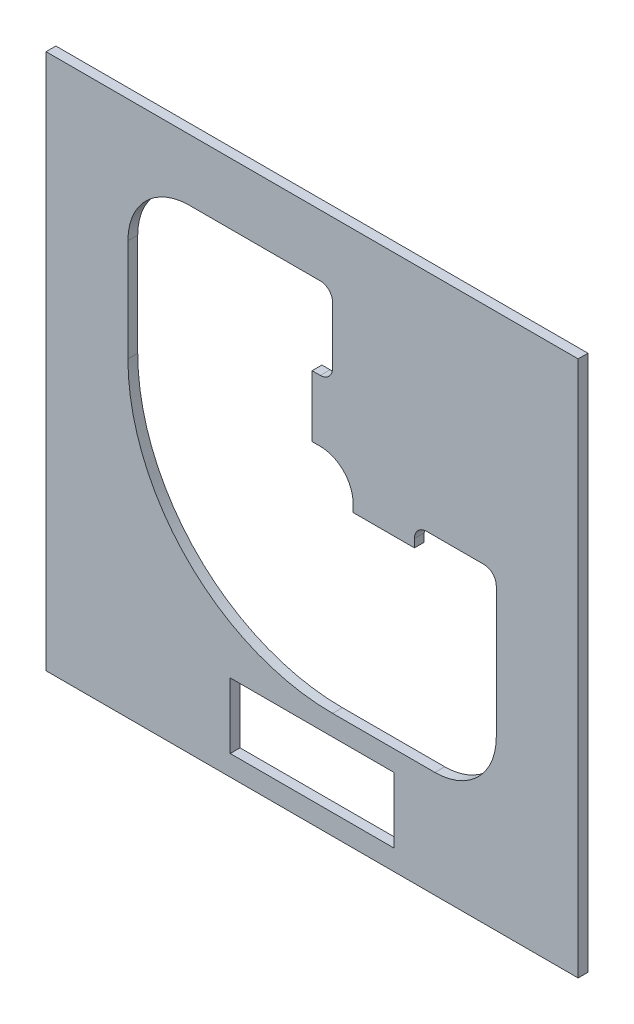
from build123d import *

# Parameters (mm, degrees)
BOSS_EXTRUDE1_DEPTH = 0.12
FILLET2_R           = 1.5
FILLET3_R           = 5
BOSS_EXTRUDE2_DEPTH = 0.12
SKETCH5_W           = 1
SKETCH5_H           = 13.1
SKETCH5_W_2         = 2.922992305
SKETCH5_H_2         = 2.818599723
BOSS_EXTRUDE3_DEPTH = 0.12
FILLET5_R           = 0.3
FILLET6_R           = 0.8


with BuildPart() as part:
    # Sketch1 → Boss-Extrude1 (new, symmetric)
    with BuildSketch(Plane.XY):
        Polygon((0, 0), (-11, 0), (-11, 10.5), (-11, 11), (0, 11), (0, 10.5), align=None)
        Polygon((-1, 0.5), (-1, 5.5), (-3, 5.5), (-3, 5), (-4.5, 5), (-4.5, 6), (-5.5, 6), (-5.5, 7.5), (-5, 7.5), (-5, 9.5), (-10, 9.5), (-10, 0.5), align=None, mode=Mode.SUBTRACT)
    extrude(amount=BOSS_EXTRUDE1_DEPTH, both=True)

    # Fillet2
    fillet2_edges = [part.edges().sort_by_distance(p)[0] for p in [
        (-1, 0.5, 0),
        (-10, 9.5, 0),
    ]]
    fillet(fillet2_edges, radius=FILLET2_R)

    # Fillet3
    fillet3_edges = [part.edges().sort_by_distance(p)[0] for p in [
        (-10, 0.5, 0),
    ]]
    fillet(fillet3_edges, radius=FILLET3_R)

    # Sketch4 → Boss-Extrude2 (add, symmetric)
    with BuildSketch(Plane.XY):
        Polygon((0, 0), (0, -2.1), (-11, -2.1), (-11, 0), (-7.5, 0), (-7.5, -1.6), (-3.5, -1.6), (-3.5, 0), align=None)
    extrude(amount=BOSS_EXTRUDE2_DEPTH, both=True)

    # Sketch5 → Boss-Extrude3 (add, symmetric)
    with BuildSketch(Plane.XY):
        with Locations((-11.5, 4.45)):
            Rectangle(SKETCH5_W, SKETCH5_H)
        with Locations((0.5, 4.45)):
            Rectangle(SKETCH5_W, SKETCH5_H)
        with Locations((-1.978875572, 8.357232245)):
            Rectangle(SKETCH5_W_2, SKETCH5_H_2)
    extrude(amount=BOSS_EXTRUDE3_DEPTH, both=True)

    # Fillet5
    fillet5_edges = [part.edges().sort_by_distance(p)[0] for p in [
        (-1, 5.5, 0),
        (-3, 5.5, 0),
        (-5, 7.5, 0),
        (-5, 9.5, 0),
    ]]
    fillet(fillet5_edges, radius=FILLET5_R)

    # Fillet6
    fillet6_edges = [part.edges().sort_by_distance(p)[0] for p in [
        (-4.5, 6, 0),
    ]]
    fillet(fillet6_edges, radius=FILLET6_R)


solid = part.part
